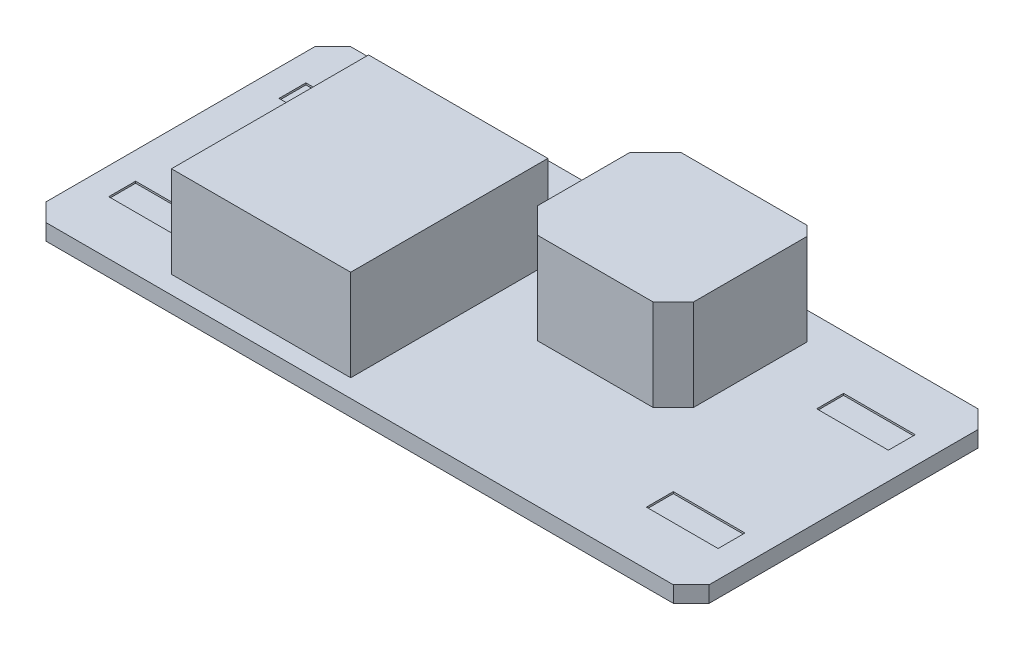
from build123d import *

# Parameters (mm, degrees)
ESBO_O1_W                = 37
ESBO_O1_H                = 17
RESSALTO_EXTRUS_O1_DEPTH = 0.45
ESBO_O2_W                = 10
ESBO_O2_H                = 11
RESSALTO_EXTRUS_O2_DEPTH = 5.1
RESSALTO_EXTRUS_O3_DEPTH = 5.1
ESBO_O4_W                = 4
ESBO_O4_H                = 1.5
CORTE_EXTRUS_O1_DEPTH    = 0.1
CHANFRO1_SIZE            = 1


with BuildPart() as part:
    # Esboço1 → Ressalto-extrusão1 (new, symmetric)
    with BuildSketch(Plane(origin=(0, 0, 0), x_dir=(1, 0, 0), z_dir=(0, 1, 0))):
        Rectangle(ESBO_O1_W, ESBO_O1_H)
    extrude(amount=RESSALTO_EXTRUS_O1_DEPTH, both=True)

    # Esboço2 → Ressalto-extrusão2 (add)
    with BuildSketch(Plane(origin=(0, 0.45, 0), x_dir=(1, 0, 0), z_dir=(0, 1, 0))):
        with Locations((-6.5, -2)):
            Rectangle(ESBO_O2_W, ESBO_O2_H)
    extrude(amount=RESSALTO_EXTRUS_O2_DEPTH)

    # Esboço3 → Ressalto-extrusão3 (add)
    with BuildSketch(Plane(origin=(0, 0.45, 0), x_dir=(1, 0, 0), z_dir=(0, 1, 0))):
        Polygon((0.5, 0.910833496), (0.5, 6.089166504), (1.910833496, 7.5), (8.967936907, 7.5), (9.5, 6.967936907), (9.5, 0.62041406), (8.37958594, -0.5), (1.910833496, -0.5), align=None)
    extrude(amount=RESSALTO_EXTRUS_O3_DEPTH)

    # Esboço4 → Corte-extrusão1 (cut)
    with BuildSketch(Plane(origin=(0, 0.45, 0), x_dir=(1, 0, 0), z_dir=(0, 1, 0))):
        with Locations((-15, 4.75)):
            Rectangle(ESBO_O4_W, ESBO_O4_H)
        with Locations((-15, -4.75)):
            Rectangle(ESBO_O4_W, ESBO_O4_H)
        with Locations((15, -4.75)):
            Rectangle(ESBO_O4_W, ESBO_O4_H)
        with Locations((15, 4.75)):
            Rectangle(ESBO_O4_W, ESBO_O4_H)
    extrude(amount=-CORTE_EXTRUS_O1_DEPTH, mode=Mode.SUBTRACT)

    # Chanfro1
    chanfro1_edges = [part.edges().sort_by_distance(p)[0] for p in [
        (-18.5, 0, -8.5),
        (18.5, 0, -8.5),
        (18.5, 0, 8.5),
        (-18.5, 0, 8.5),
    ]]
    chamfer(chanfro1_edges, length=CHANFRO1_SIZE)


solid = part.part
